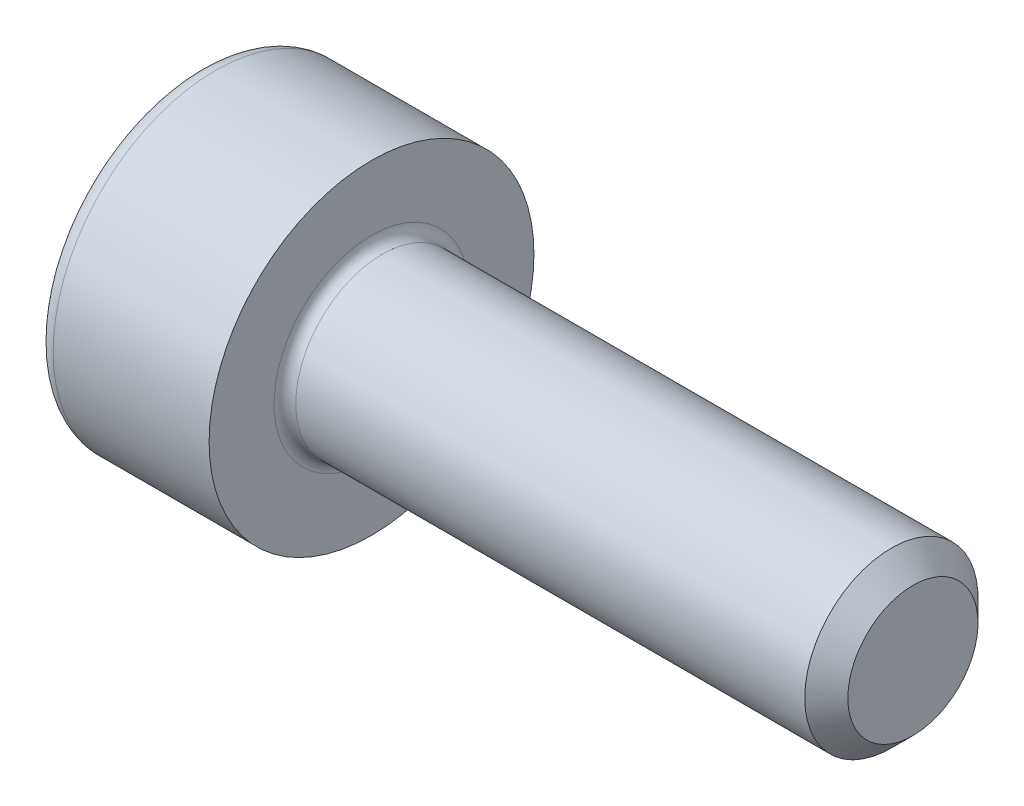
from build123d import *

# Parameters (mm, degrees)
FILLET1_R   = 0.1
FILLET2_R   = 0.16
HEX_2_DEPTH = 0.7


with BuildPart() as part:
    # BodySke → Base-Revolve (revolve)
    with BuildSketch(Plane.XY, mode=Mode.PRIVATE) as base_revolve_sk:
        Polygon((0, 0), (0, 1.5), (1.6, 1.5), (1.6, 0.8), (6.401, 0.8), (6.6, 0.601), (6.6, 0), align=None)
    revolve(base_revolve_sk.sketch.rotate(Axis((-31.75, 0, 0), (1, 0, 0)), 90), axis=Axis((-31.75, 0, 0), (1, 0, 0)))

    # Fillet1
    fillet1_edges = [part.edges().sort_by_distance(p)[0] for p in [
        (1.6, 0, -0.8),
    ]]
    fillet(fillet1_edges, radius=FILLET1_R)

    # Fillet2
    fillet2_edges = [part.edges().sort_by_distance(p)[0] for p in [
        (0, 0, -1.5),
    ]]
    fillet(fillet2_edges, radius=FILLET2_R)

    # Sketch2 → Hex-PreBroach (revolve, cut)
    with BuildSketch(Plane.XY, mode=Mode.PRIVATE) as hex_prebroach_sk:
        Polygon((0, 0.76), (0.7, 0.76), (1.138786205, 0), (0, 0), align=None)
    revolve(hex_prebroach_sk.sketch.rotate(Axis((0, 0, 0), (1, 0, 0)), 90), axis=Axis((0, 0, 0), (1, 0, 0)), mode=Mode.SUBTRACT)

    # Sketch3 → Hex 2 (cut)
    with BuildSketch(Plane(origin=(0, 0, 0), x_dir=(0, 0.500000000000001, 0.866025403784438), z_dir=(-1, 0, 0))):
        Polygon((0.438786205, 0.76), (-0.438786205, 0.76), (-0.877572409, 0), (-0.438786205, -0.76), (0.438786205, -0.76), (0.877572409, 0), align=None)
    extrude(amount=-HEX_2_DEPTH, mode=Mode.SUBTRACT)


solid = part.part
